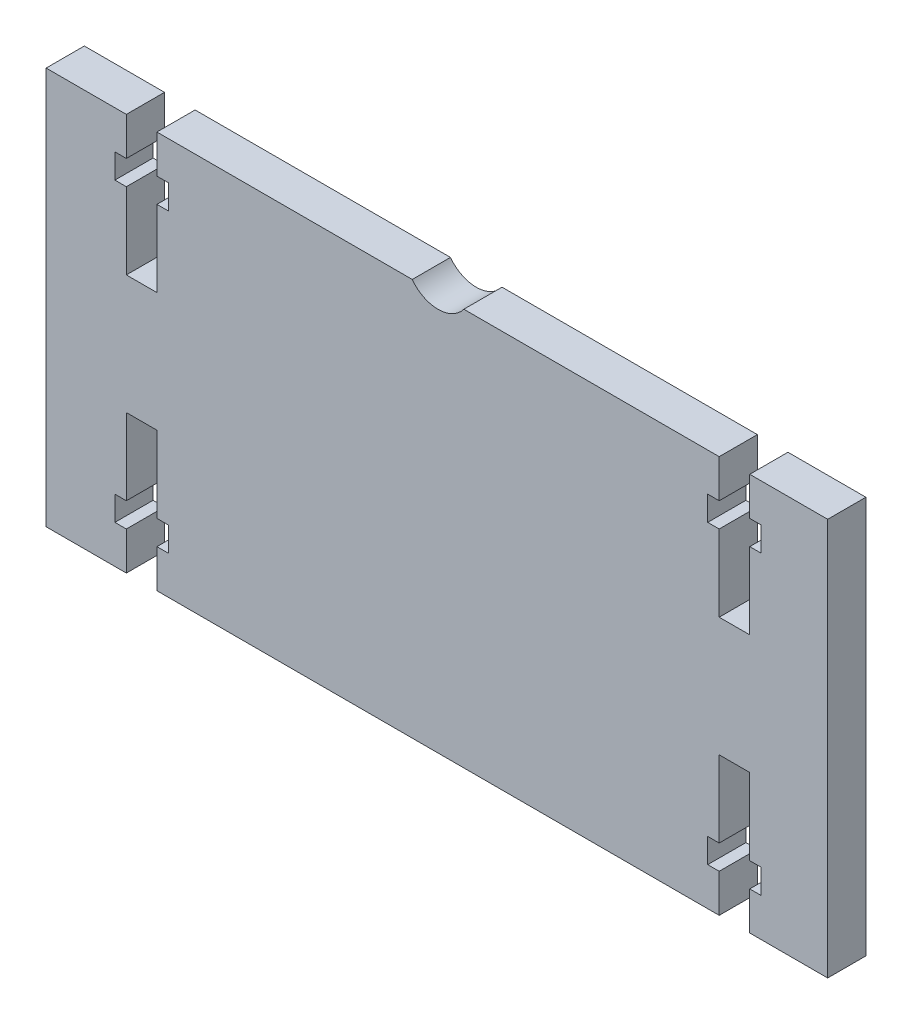
from build123d import *

# Parameters (mm, degrees)
SKETCH1_W           = 102.3
SKETCH1_H           = 52
BOSS_EXTRUDE1_DEPTH = 5
CUT_EXTRUDE1_DEPTH  = 5
CUT_EXTRUDE2_DEPTH  = 10
SKETCH9_R           = 4.2
CUT_EXTRUDE3_DEPTH  = 5


with BuildPart() as part:
    # Sketch1 → Boss-Extrude1 (new body)
    with BuildSketch(Plane.XY):
        Rectangle(SKETCH1_W, SKETCH1_H)
    extrude(amount=BOSS_EXTRUDE1_DEPTH)

    # Sketch3 → Cut-Extrude1 (cut)
    with BuildSketch(Plane.XY.offset(5)):
        Polygon((-36.65, 17.8), (-36.65, 7.8), (-40.65, 7.8), (-40.65, 17.8), (-42.15, 17.8), (-42.15, 21), (-40.65, 21), (-40.65, 26), (-36.65, 26), (-36.65, 21), (-35.15, 21), (-35.15, 17.8), align=None)
        Polygon((-40.65, -7.8), (-40.65, -17.8), (-42.15, -17.8), (-42.15, -21), (-40.65, -21), (-40.65, -26), (-36.65, -26), (-36.65, -21), (-35.15, -21), (-35.15, -17.8), (-36.65, -17.8), (-36.65, -7.8), align=None)
    extrude(amount=-CUT_EXTRUDE1_DEPTH, mode=Mode.SUBTRACT)

    # Sketch8 → Cut-Extrude2 (cut)
    with BuildSketch(Plane.XY.offset(5)):
        Polygon((36.95, 26), (36.95, 21), (35.45, 21), (35.45, 17.8), (36.95, 17.8), (36.95, 7.8), (40.95, 7.8), (40.95, 17.8), (42.45, 17.8), (42.45, 21), (40.95, 21), (40.95, 26), align=None)
        Polygon((40.95, -17.8), (42.45, -17.8), (42.45, -21), (40.95, -21), (40.95, -26), (36.95, -26), (36.95, -21), (35.45, -21), (35.45, -17.8), (36.95, -17.8), (36.95, -7.8), (40.95, -7.8), align=None)
    extrude(amount=-CUT_EXTRUDE2_DEPTH, mode=Mode.SUBTRACT)

    # Sketch9 → Cut-Extrude3 (cut)
    with BuildSketch(Plane.XY.offset(5)):
        with Locations((0.15, 28.5)):
            Circle(SKETCH9_R)
    extrude(amount=-CUT_EXTRUDE3_DEPTH, mode=Mode.SUBTRACT)


solid = part.part
